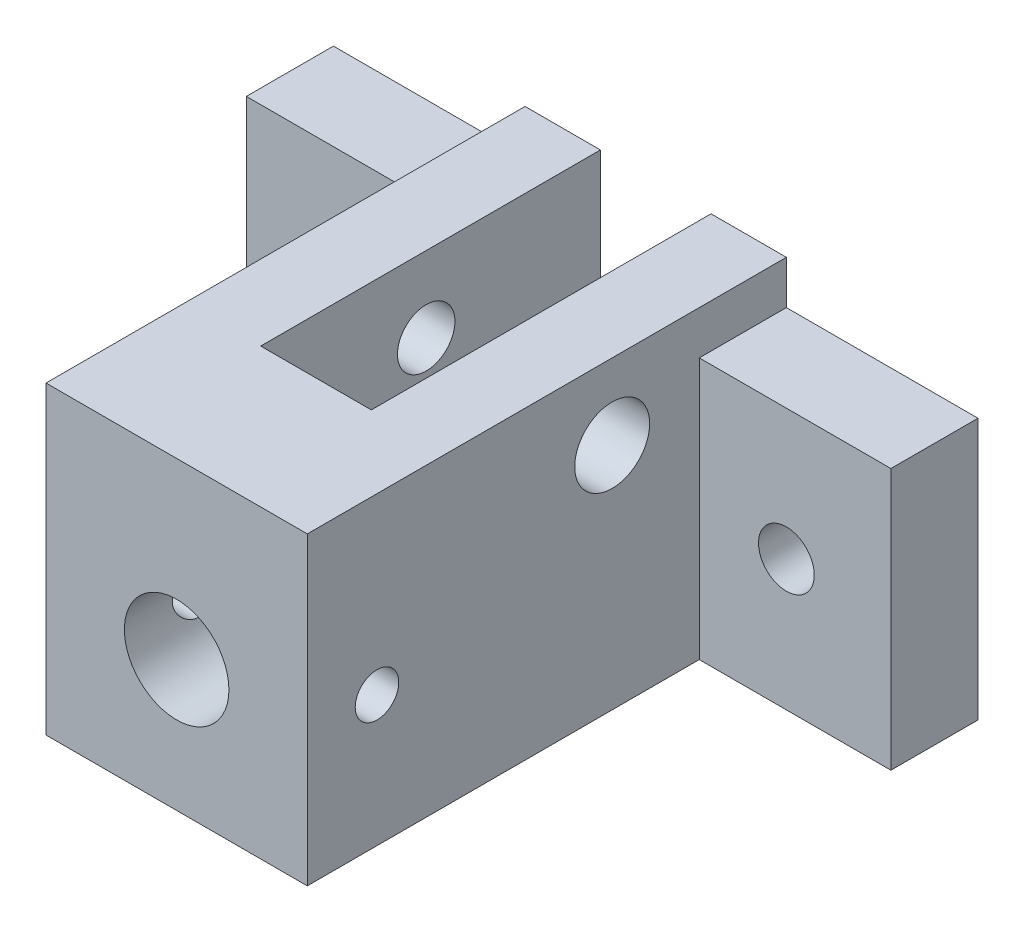
from build123d import *

# Parameters (mm, degrees)
BOSS_EXTRUDE1_DEPTH             = 8.75
F_6_0_6_DIAMETER_HOLE1_D        = 6
TAP_DRILL_FOR_M3X0_5_TAP1_D     = 2.5
M3_CLEARANCE_HOLE1_D            = 3.2
M3_CLEARANCE_HOLE1_DEPTH        = 5
M3_CLEARANCE_HOLE1_TIP          = 0.96137699
M4_CLEARANCE_HOLE1_D            = 4.3
M4_CLEARANCE_HOLE1_DEPTH        = 4.325
M4_CLEARANCE_HOLE1_TIP          = 1.291850331
TAP_DRILL_FOR_M4X0_7_TAP1_D     = 3.3
TAP_DRILL_FOR_M4X0_7_TAP1_DEPTH = 4.325
TAP_DRILL_FOR_M4X0_7_TAP1_TIP   = 0.991420021
CUT_EXTRUDE1_DEPTH              = 31.414840202
CUT_EXTRUDE1_DEPTH_BACK         = 31.414840202
SKETCH16_W                      = 11
SKETCH16_H                      = 2.5


with BuildPart() as part:
    # Sketch1 → Boss-Extrude1 (new, symmetric)
    with BuildSketch(Plane(origin=(0, 0, 0), x_dir=(1, 0, 0), z_dir=(0, 1, 0))):
        Polygon((-7.5, 0), (7.5, 0), (7.5, 22.5), (18.5, 22.5), (18.5, 27.5), (3.175, 27.5), (3.175, 11.175), (3.175, 8), (0, 8), (-3.175, 8), (-3.175, 11.175), (-3.175, 27.5), (-18.5, 27.5), (-18.5, 22.5), (-7.5, 22.5), align=None)
    extrude(amount=BOSS_EXTRUDE1_DEPTH, both=True)

    # Ø6.0 (6) Diameter Hole1 (through all)
    with Locations(Plane.XY):
        with Locations((0, -1.25)):
            Hole(F_6_0_6_DIAMETER_HOLE1_D / 2)

    # Tap Drill for M3x0.5 Tap1 (through all)
    with Locations(Plane.ZY.offset(7.5)):
        with Locations((-4, -1.25)):
            Hole(TAP_DRILL_FOR_M3X0_5_TAP1_D / 2)

    # M3 Clearance Hole1
    with Locations(Plane.XY.offset(-22.5)):
        with Locations((12.5, -1.25), (-12.5, -1.25)):
            Hole(M3_CLEARANCE_HOLE1_D / 2, depth=M3_CLEARANCE_HOLE1_DEPTH)
            with Locations((0, 0, -(M3_CLEARANCE_HOLE1_DEPTH + M3_CLEARANCE_HOLE1_TIP / 2))):  # 118° drill point
                Cone(0, M3_CLEARANCE_HOLE1_D / 2, M3_CLEARANCE_HOLE1_TIP, mode=Mode.SUBTRACT)

    # M4 Clearance Hole1
    with Locations(Plane(origin=(7.5, 0, 0), x_dir=(0, 0, -1), z_dir=(1, 0, 0))):
        with Locations((17.5, 4.41)):
            Hole(M4_CLEARANCE_HOLE1_D / 2, depth=M4_CLEARANCE_HOLE1_DEPTH)
            with Locations((0, 0, -(M4_CLEARANCE_HOLE1_DEPTH + M4_CLEARANCE_HOLE1_TIP / 2))):  # 118° drill point
                Cone(0, M4_CLEARANCE_HOLE1_D / 2, M4_CLEARANCE_HOLE1_TIP, mode=Mode.SUBTRACT)

    # Tap Drill for M4x0.7 Tap1
    with Locations(Plane(origin=(-3.175, 0, 0), x_dir=(0, 0, -1), z_dir=(1, 0, 0))):
        with Locations((17.5, 4.41)):
            Hole(TAP_DRILL_FOR_M4X0_7_TAP1_D / 2, depth=TAP_DRILL_FOR_M4X0_7_TAP1_DEPTH)
            with Locations((0, 0, -(TAP_DRILL_FOR_M4X0_7_TAP1_DEPTH + TAP_DRILL_FOR_M4X0_7_TAP1_TIP / 2))):  # 118° drill point
                Cone(0, TAP_DRILL_FOR_M4X0_7_TAP1_D / 2, TAP_DRILL_FOR_M4X0_7_TAP1_TIP, mode=Mode.SUBTRACT)

    # Sketch16 → Cut-Extrude1 (cut, two sides: drawn at the far end of the back side and taken through both)
    with BuildSketch(Plane.XY.offset(-22.5).offset(-CUT_EXTRUDE1_DEPTH_BACK)):
        with Locations((-13, 7.5)):
            Rectangle(SKETCH16_W, SKETCH16_H)
        with Locations((13, 7.5)):
            Rectangle(SKETCH16_W, SKETCH16_H)
    extrude(amount=CUT_EXTRUDE1_DEPTH + CUT_EXTRUDE1_DEPTH_BACK, mode=Mode.SUBTRACT)


solid = part.part
